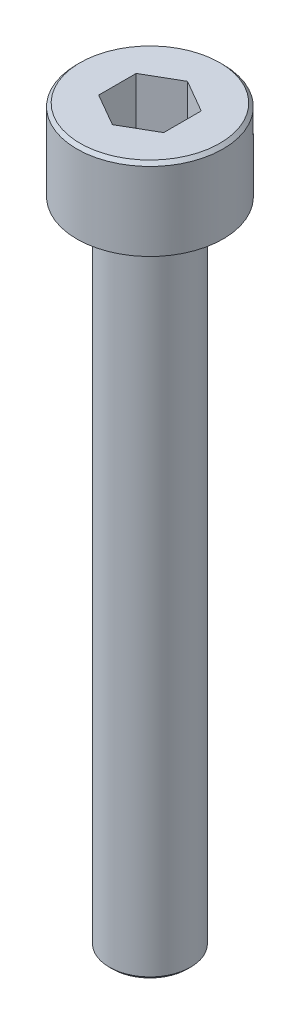
from build123d import *

# Parameters (mm, degrees)
SMUSSO1_SIZE             = 0.1
TAGLIO_ESTRUSIONE1_DEPTH = 2


with BuildPart() as part:
    # Schizzo1 → Rivoluzione1 (revolve)
    with BuildSketch(Plane.XY, mode=Mode.PRIVATE) as rivoluzione1_sk:
        Polygon((0, 0), (0, 2.5), (2.25, 2.5), (2.25, 0), (1.25, 0), (1.25, -20), (0, -20), align=None)
    revolve(rivoluzione1_sk.sketch.rotate(Axis((0, 28.388481997, 0), (0, -1, 0)), 90), axis=Axis((0, 28.388481997, 0), (0, -1, 0)))

    # Smusso1
    smusso1_edges = [part.edges().sort_by_distance(p)[0] for p in [
        (0, -20, -1.25),
        (0, 2.5, -2.25),
    ]]
    chamfer(smusso1_edges, length=SMUSSO1_SIZE)

    # Schizzo2 → Taglio-Estrusione1 (cut)
    with BuildSketch(Plane(origin=(0, 2.5, 0), x_dir=(1, 0, 0), z_dir=(0, 1, 0))):
        Polygon((0, 1.154700538), (-1, 0.577350269), (-1, -0.577350269), (0, -1.154700538), (1, -0.577350269), (1, 0.577350269), align=None)
    extrude(amount=-TAGLIO_ESTRUSIONE1_DEPTH, mode=Mode.SUBTRACT)


solid = part.part
